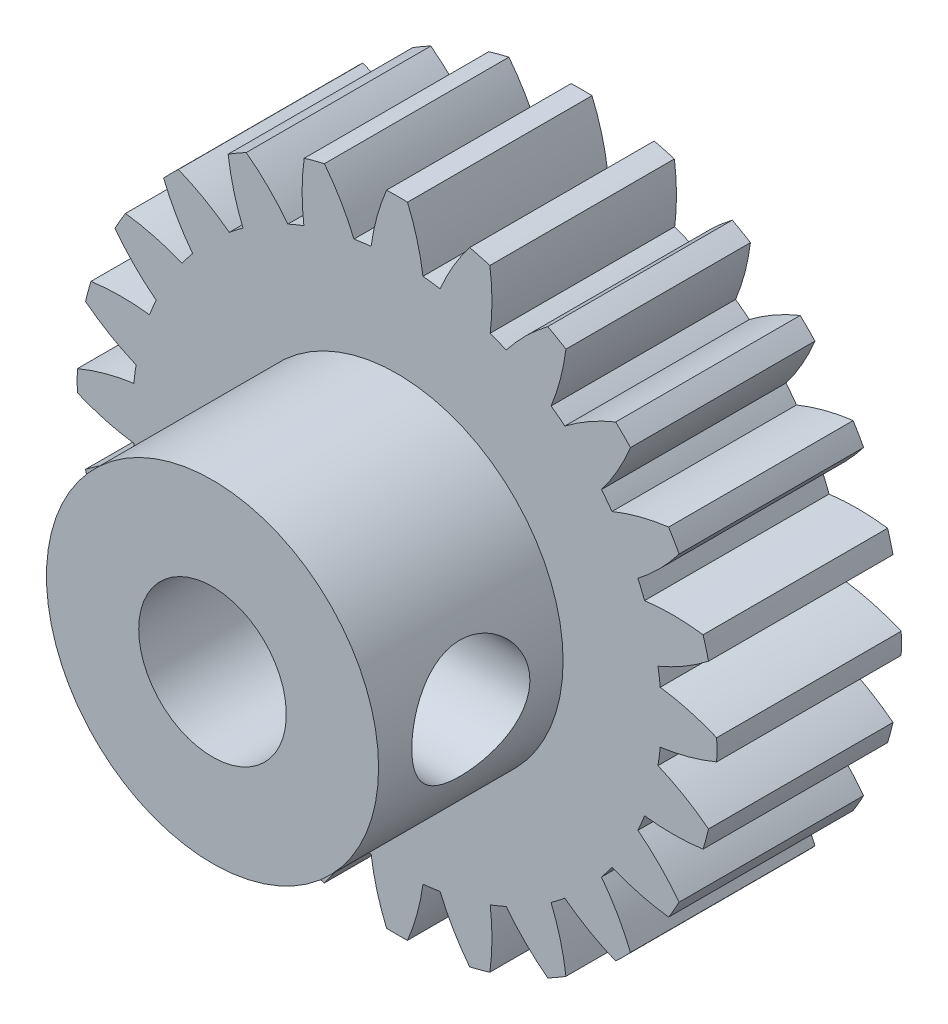
from build123d import *

# Parameters (mm, degrees)
SKETCH1_W          = 6.879166709
SKETCH1_H          = 3.96875
CUT_EXTRUDE1_DEPTH = 11.506990329
CIRPATTERN1_COUNT  = 24
SKETCH26_W         = 3.571875
SKETCH26_H         = 3.96875
HOLE1_D            = 3.175
SKETCH29_W         = 1.27
SKETCH29_H         = 5.926666709


with BuildPart() as part:
    # Sketch1 → Revolve1 (revolve)
    with BuildSketch(Plane(origin=(0, 0, 0), x_dir=(1, 0, 0), z_dir=(0, 1, 0))):
        with Locations((3.439583355, -1.984375)):
            Rectangle(SKETCH1_W, SKETCH1_H)
    revolve(axis=Axis((0, 0, 0), (0, 0, 1)))

    # Sketch2 → Cut-Extrude1 (cut, through all)
    with BuildSketch(Plane(origin=(0, 0, 0), x_dir=(-1, 0, 0), z_dir=(0, 0, -1))):
        with BuildLine():
            ThreePointArc((4.702545407, 5.020856631), (4.187771356, 5.457609887), (3.632666778, 5.841803376))
            ThreePointArc((3.632666778, 5.841803376), (3.513181537, 5.22234108), (3.313448673, 4.623912268))
            ThreePointArc((3.313448673, 4.623912268), (3.46296478, 4.513023566), (3.608772657, 4.397302205))
            ThreePointArc((3.608772657, 4.397302205), (4.135115832, 4.74511411), (4.702545407, 5.020856631))
        make_face()
    cut_extrude1 = extrude(amount=-CUT_EXTRUDE1_DEPTH, mode=Mode.SUBTRACT)

    # CirPattern1: Cut-Extrude1 ×24 about axis
    cirpattern1_axis = Axis((0, 0, 0), (0, 0, 1))
    for i in range(1, CIRPATTERN1_COUNT):
        add(cut_extrude1.rotate(cirpattern1_axis, i * 360 / CIRPATTERN1_COUNT), mode=Mode.SUBTRACT)

    # Sketch26 → Revolve2 (revolve)
    with BuildSketch(Plane(origin=(0, 0, 0), x_dir=(1, 0, 0), z_dir=(0, 1, 0))):
        with Locations((1.7859375, -5.953125)):
            Rectangle(SKETCH26_W, SKETCH26_H)
    revolve(axis=Axis((0, 0, 3.96875), (0, 0, 1)))

    # Hole1 (through all)
    with Locations(Plane(origin=(0, 0, 0), x_dir=(-1, 0, 0), z_dir=(0, 0, -1))):
        with Locations((0, 0)):
            Hole(HOLE1_D / 2)

    # Sketch29 → M2 Clearance Hole1 (revolve, cut)
    with BuildSketch(Plane(origin=(0.9525, 0, 5.953125), x_dir=(0, 0, 1), z_dir=(0, 1, 0))):
        with Locations((0.635, 2.963333355)):
            Rectangle(SKETCH29_W, SKETCH29_H)
    revolve(axis=Axis((-5.3975, 0, 5.953125), (1, 0, 0)), mode=Mode.SUBTRACT)


solid = part.part
